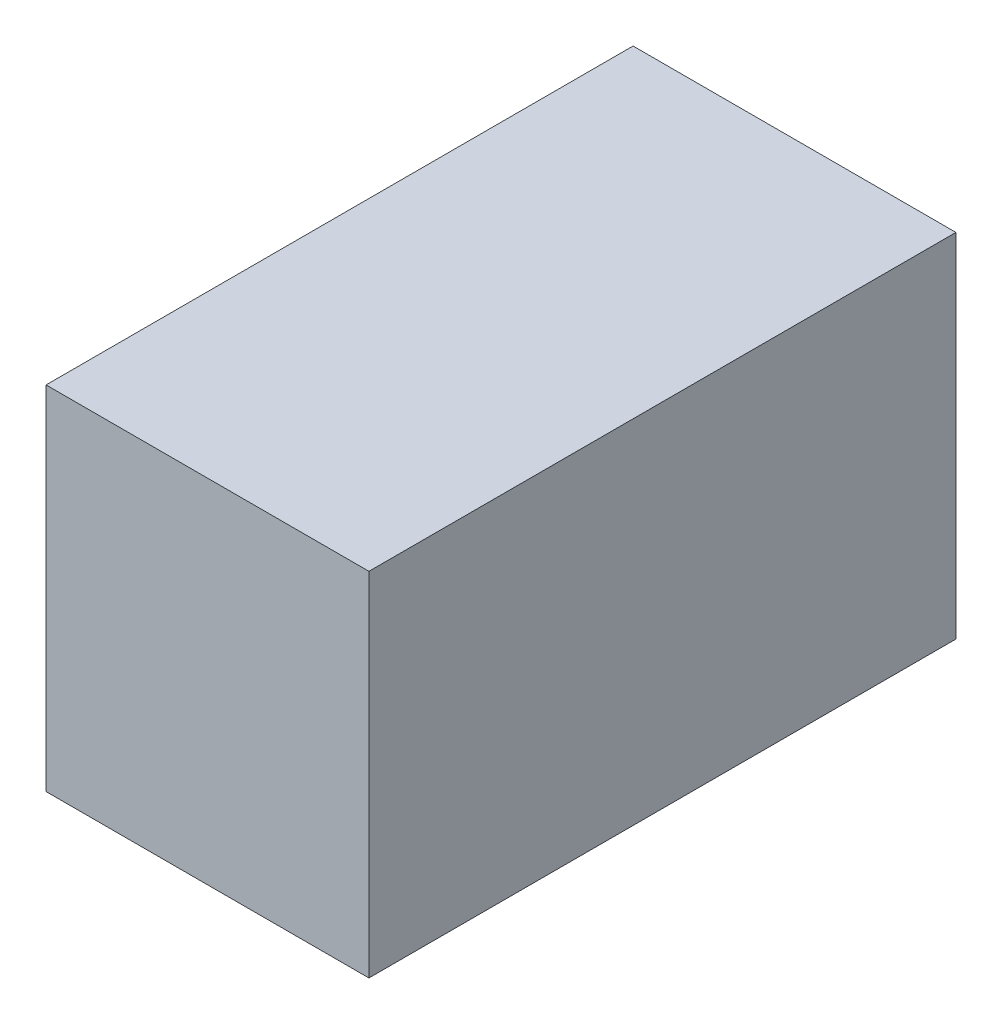
from build123d import *

# Parameters (mm, degrees)
SKETCH1_W           = 11
SKETCH1_H           = 20
BOSS_EXTRUDE1_DEPTH = 12


with BuildPart() as part:
    # Sketch1 → Boss-Extrude1 (new body)
    with BuildSketch(Plane(origin=(0, 0, 0), x_dir=(1, 0, 0), z_dir=(0, 1, 0))):
        Rectangle(SKETCH1_W, SKETCH1_H)
    extrude(amount=BOSS_EXTRUDE1_DEPTH)


solid = part.part
